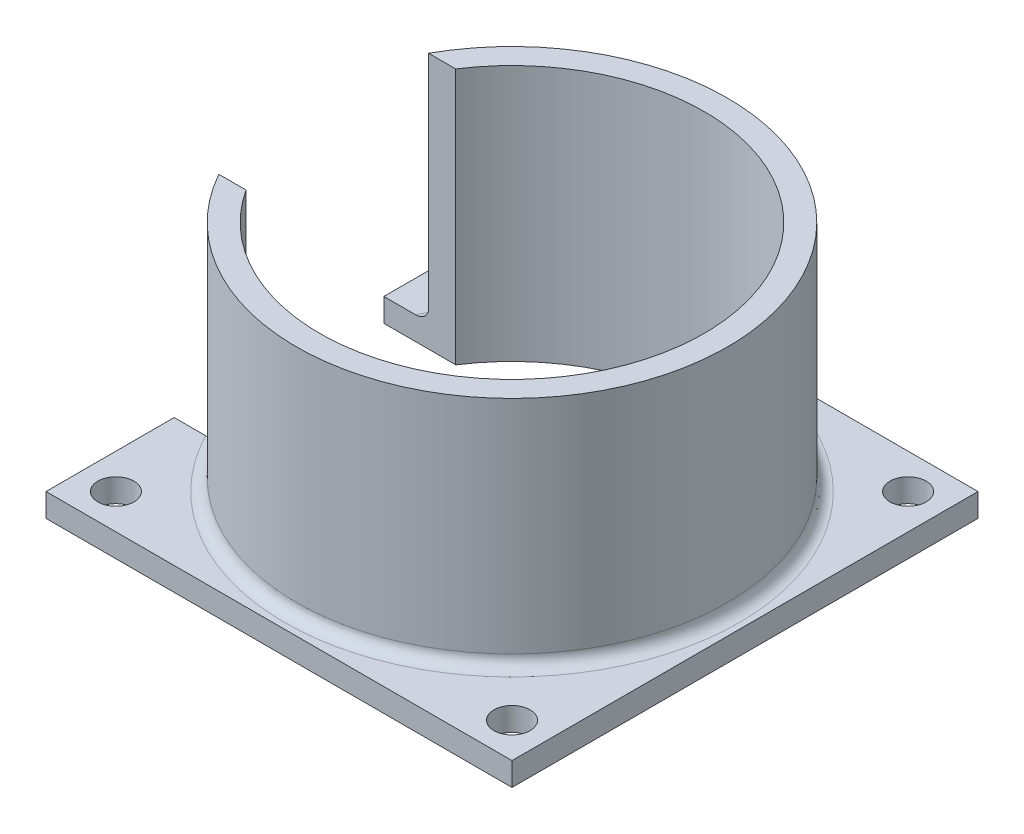
from build123d import *

# Parameters (mm, degrees)
SKETCH_1_W          = 40
SKETCH_1_H          = 40
SKETCH_1_R          = 1.55
SKETCH_1_R_2        = 16.5
EXTRUDE_1_DEPTH     = 2
SKETCH_2_R          = 18.5
SKETCH_2_R_2        = 16.5
EXTRUDE_2_DEPTH     = 20
FILLET_1_R          = 1
CUT_EXTRUDE_1_DEPTH = 36.832945734


with BuildPart() as part:
    # 草图1 → 凸台-拉伸1 (new body)
    with BuildSketch(Plane(origin=(0, 0, 0), x_dir=(1, 0, 0), z_dir=(0, 1, 0))):
        Rectangle(SKETCH_1_W, SKETCH_1_H)
        with Locations(Location((-17, 17, 0), (0, 0, 270))):
            Circle(SKETCH_1_R, mode=Mode.SUBTRACT)
        with Locations(Location((17, 17, 0), (0, 0, 270))):
            Circle(SKETCH_1_R, mode=Mode.SUBTRACT)
        with Locations(Location((17, -17, 0), (0, 0, 270))):
            Circle(SKETCH_1_R, mode=Mode.SUBTRACT)
        with Locations(Location((-17, -17, 0), (0, 0, 270))):
            Circle(SKETCH_1_R, mode=Mode.SUBTRACT)
        with Locations(Location((0, 0, 0), (0, 0, 270))):
            Circle(SKETCH_1_R_2, mode=Mode.SUBTRACT)
    extrude(amount=EXTRUDE_1_DEPTH)

    # 草图2 → 凸台-拉伸2 (add)
    with BuildSketch(Plane(origin=(0, 2, 0), x_dir=(1, 0, 0), z_dir=(0, 1, 0))):
        with Locations(Location((0, 0, 0), (0, 0, 270))):
            Circle(SKETCH_2_R)
        with Locations(Location((0, 0, 0), (0, 0, 270))):
            Circle(SKETCH_2_R_2, mode=Mode.SUBTRACT)
    extrude(amount=EXTRUDE_2_DEPTH)

    # 圆角1
    fillet_1_edges = [part.edges().sort_by_distance(p)[0] for p in [
        (0, 2, -18.5),
    ]]
    fillet(fillet_1_edges, radius=FILLET_1_R)

    # 草图3 → 切除-拉伸1 (cut, through all)
    with BuildSketch(Plane.XZ):
        with BuildLine():
            ThreePointArc((-13.829316686, -9), (-15.818244614, -4.693946883), (-16.5, 0))
            ThreePointArc((-16.5, 0), (-15.818244614, 4.693946883), (-13.829316686, 9))
            Line((-13.829316686, 9), (-20, 9))
            Line((-20, 9), (-20, -9))
            Line((-20, -9), (-13.829316686, -9))
        make_face()
    extrude(amount=-CUT_EXTRUDE_1_DEPTH, mode=Mode.SUBTRACT)


solid = part.part
